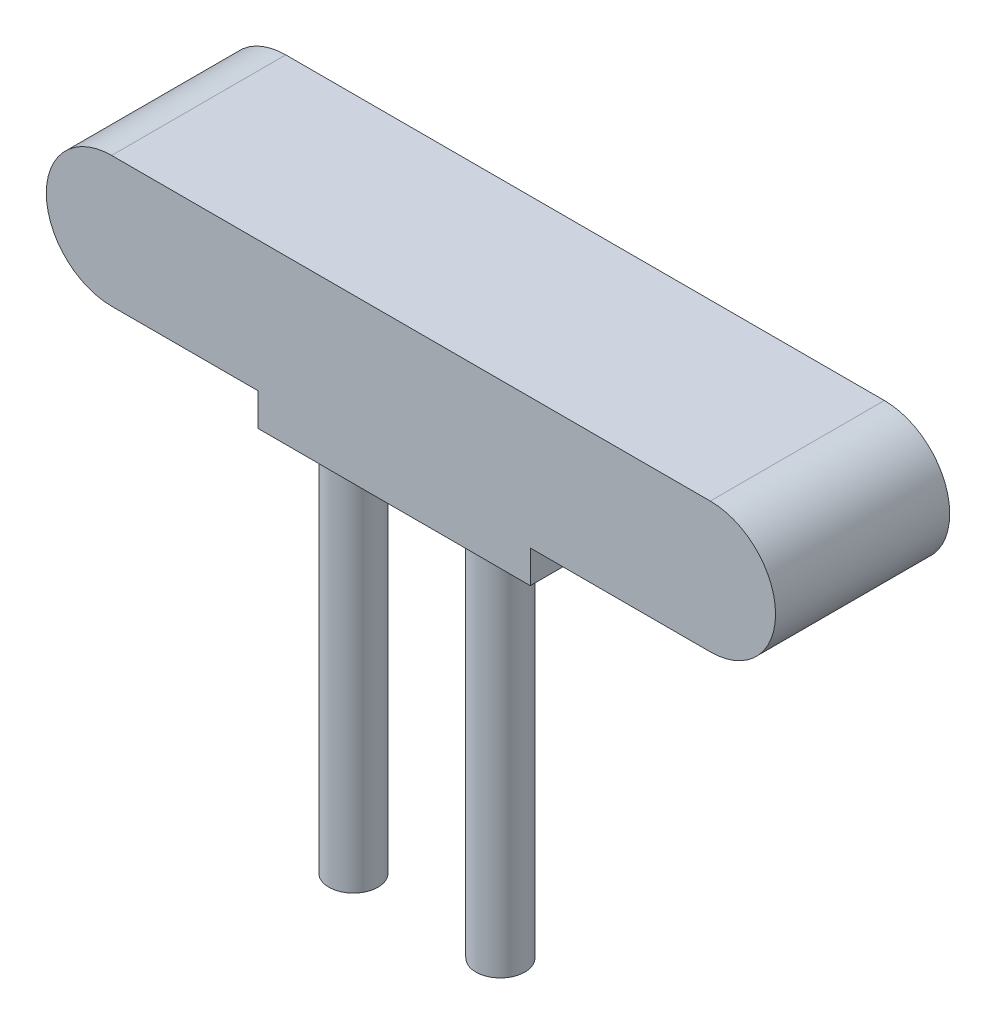
from build123d import *

# Parameters (mm, degrees)
SKETCH1_W           = 63.5
SKETCH1_H           = 15.24
BOSS_EXTRUDE1_DEPTH = 7.62
BOSS_EXTRUDE2_DEPTH = 40.64
SKETCH3_R           = 5.715
BOSS_EXTRUDE3_DEPTH = 86.36
SKETCH4_R           = 1.905
CUT_EXTRUDE1_DEPTH  = 12.7


with BuildPart() as part:
    # Sketch1 → Boss-Extrude1 (new body)
    with BuildSketch(Plane(origin=(0, 0, 0), x_dir=(1, 0, 0), z_dir=(0, 1, 0))):
        with Locations((31.75, 7.62)):
            Rectangle(SKETCH1_W, SKETCH1_H)
    extrude(amount=BOSS_EXTRUDE1_DEPTH)

    # Sketch2 → Boss-Extrude2 (add)
    with BuildSketch(Plane.XY):
        with BuildLine():
            Line((-34.2099732, 38.1), (105.4900268, 38.1))
            ThreePointArc((105.4900268, 38.1), (120.7300268, 22.86), (105.4900268, 7.62))
            Line((105.4900268, 7.62), (-34.2099732, 7.62))
            ThreePointArc((-34.2099732, 7.62), (-49.4499732, 22.86), (-34.2099732, 38.1))
        make_face()
    extrude(amount=-BOSS_EXTRUDE2_DEPTH)

    # Sketch3 → Boss-Extrude3 (add)
    with BuildSketch(Plane.XZ):
        with Locations(Location((14.605, -7.62, 0), (0, 0, 270))):
            Circle(SKETCH3_R)
        with Locations(Location((48.895, -7.62, 0), (0, 0, 270))):
            Circle(SKETCH3_R)
    extrude(amount=BOSS_EXTRUDE3_DEPTH)

    # Sketch4 → Cut-Extrude1 (cut)
    with BuildSketch(Plane.XZ.offset(86.36)):
        with Locations(Location((14.605, -7.62, 0), (0, 0, 270))):
            Circle(SKETCH4_R)
        with Locations(Location((48.895, -7.62, 0), (0, 0, 270))):
            Circle(SKETCH4_R)
    extrude(amount=-CUT_EXTRUDE1_DEPTH, mode=Mode.SUBTRACT)


solid = part.part
